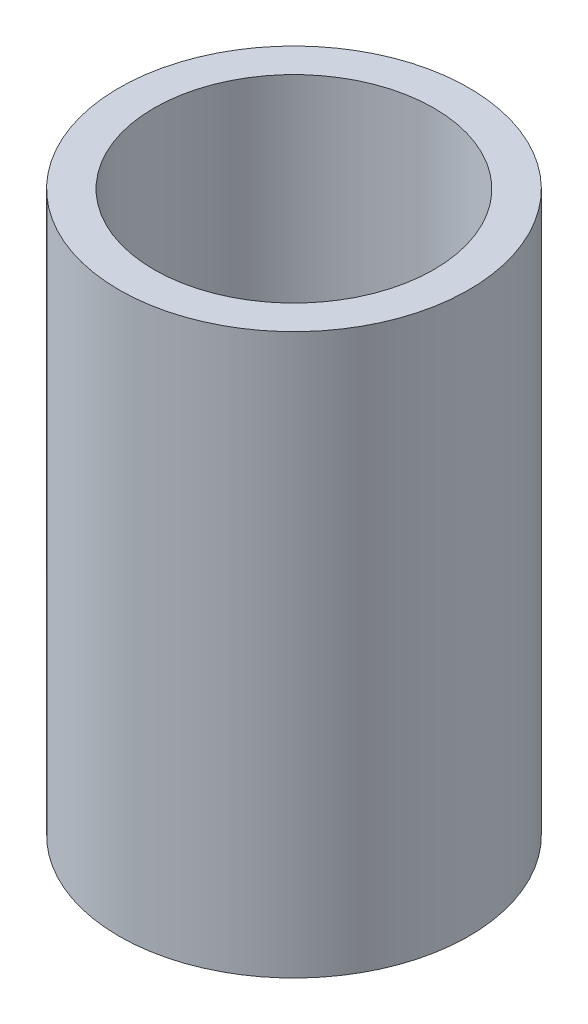
from build123d import *

# Parameters (mm, degrees)
SKETCH1_R           = 7.5
BOSS_EXTRUDE1_DEPTH = 24
CUT_EXTRUDE1_REACH  = 28.239
SKETCH2_R           = 6


with BuildPart() as part:
    # Sketch1 → Boss-Extrude1 (new body)
    with BuildSketch(Plane(origin=(0, 0, 0), x_dir=(1, 0, 0), z_dir=(0, 1, 0))):
        with Locations(Location((0, 0, 0), (0, 0, 270))):
            Circle(SKETCH1_R)
    extrude(amount=BOSS_EXTRUDE1_DEPTH)

    # Sketch2 → Cut-Extrude1 (cut, up to next)
    with BuildSketch(Plane(origin=(0, 24, 0), x_dir=(1, 0, 0), z_dir=(0, 1, 0)), mode=Mode.PRIVATE) as cut_extrude1_sk1:
        with Locations(Location((0, 0, 0), (0, 0, 270))):
            Circle(SKETCH2_R)
    cut_extrude1_tool1 = extrude(cut_extrude1_sk1.sketch, amount=-CUT_EXTRUDE1_REACH, mode=Mode.PRIVATE) & part.part
    add(cut_extrude1_tool1.solids().sort_by_distance((0, 24, 0))[0], mode=Mode.SUBTRACT)


solid = part.part
